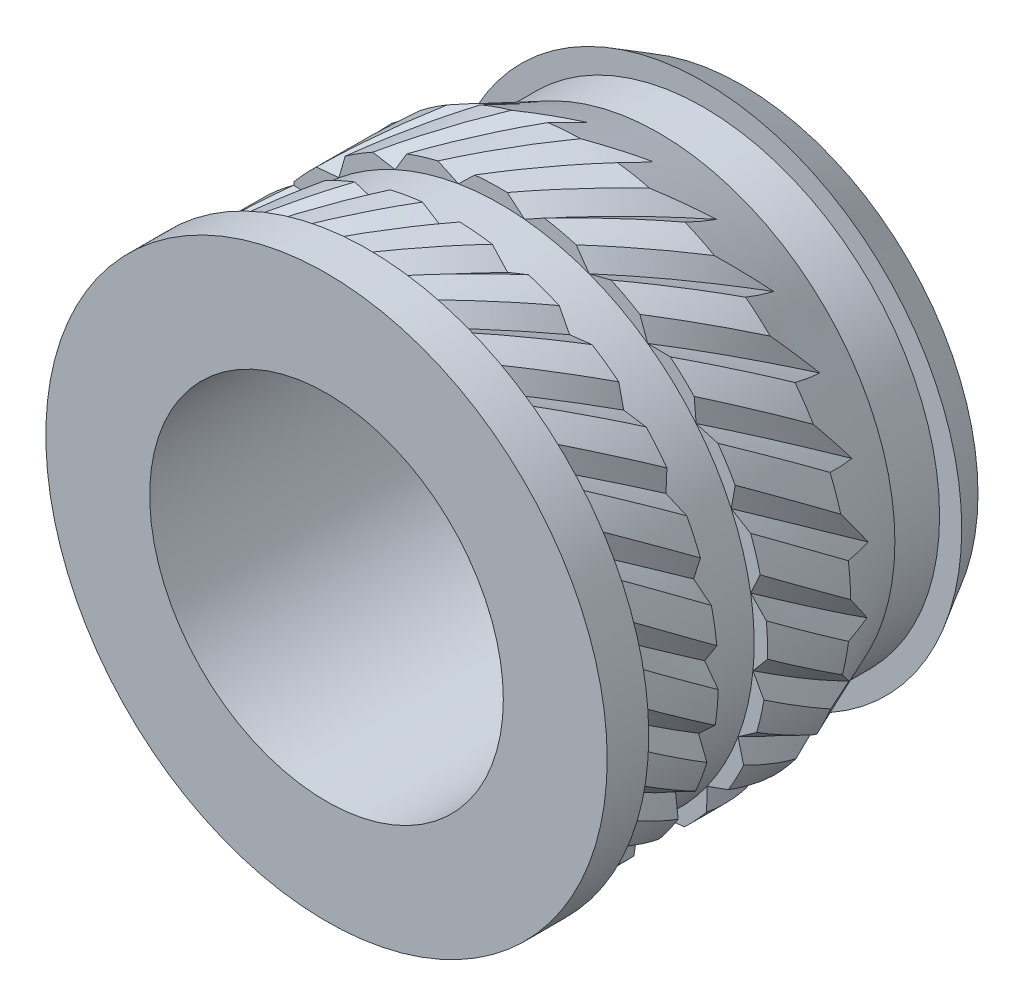
from build123d import *

# Parameters (mm, degrees)
CIRPATTERN1_COUNT = 24


with BuildPart() as part:
    # Sketch3 → Revolve1 (revolve)
    with BuildSketch(Plane(origin=(0, 0, 0), x_dir=(0, 0, -1), z_dir=(1, 0, 0)), mode=Mode.PRIVATE) as revolve1_sk:
        Polygon((-2.35, 2), (-2.35, 3.175), (-1.88, 3.175), (-1.88, 3.0225), (-0.94, 3.0225), (-0.94, 2.87), (-0.383183073, 2.87), (-0.383183073, 3.0225), (0.556816927, 3.0225), (1.41, 2.6691), (1.915428452, 2.6691), (1.915428452, 2.92), (2.35, 2.6691), (2.35, 2), align=None)
    revolve(revolve1_sk.sketch.rotate(Axis((0, 0, 2.35), (0, 0, -1)), 90), axis=Axis((0, 0, 2.35), (0, 0, -1)))

    # Cut-Sweep1: sweep along a curve in space
    with BuildLine() as cut_sweep1_path:
        add(Edge.make_bspline(
            [(0, 3.0225, 1.88), (0.263505453, 3.0225, 1.514801223), (0.791408342, 2.953028126, 0.783119266), (1.528496008, 2.647716418, -0.313119266), (1.950903753, 2.323556739, -1.044801223), (2.137230246, 2.137230246, -1.41)],
            knots=[0, 0, 0, 0, 0.333333333, 0.666666667, 1, 1, 1, 1], degree=3))
    # Sketch5 → Cut-Sweep1 (sweep, cut)
    with BuildSketch(Plane.XY.offset(1.88)):
        with BuildLine():
            Line((-0.224024249, 3.024213846), (0, 2.87))
            Line((0, 2.87), (0.224024249, 3.024213846))
            ThreePointArc((0.224024249, 3.024213846), (0, 3.0325), (-0.224024249, 3.024213846))
        make_face()
    cut_sweep1 = sweep(path=cut_sweep1_path.line, is_frenet=True, mode=Mode.SUBTRACT)

    # CirPattern1: Cut-Sweep1 ×24 about axis
    cirpattern1_axis = Axis((0, 0, 2.35), (0, 0, -1))
    for i in range(1, CIRPATTERN1_COUNT):
        add(cut_sweep1.rotate(cirpattern1_axis, i * 360 / CIRPATTERN1_COUNT), mode=Mode.SUBTRACT)


solid = part.part
